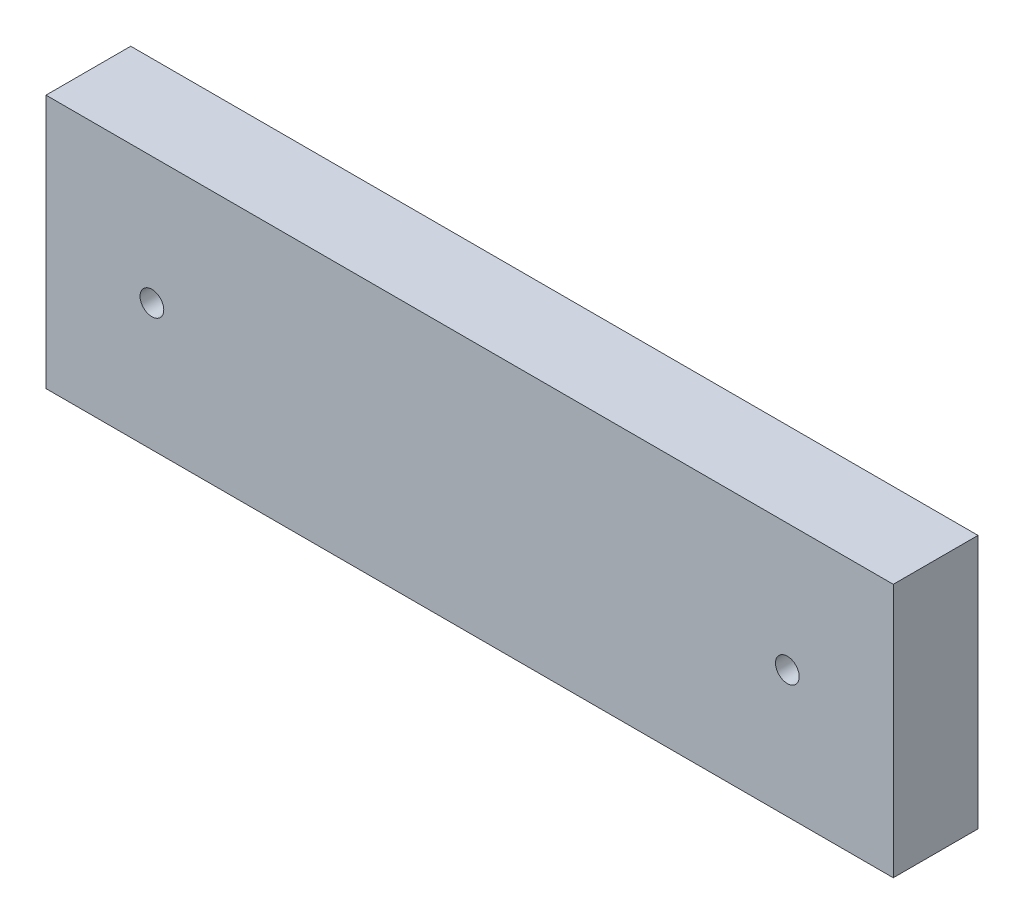
from build123d import *

# Parameters (mm, degrees)
SKETCH_1_W      = 100
SKETCH_1_H      = 30
SKETCH_1_R      = 1.4
EXTRUDE_1_DEPTH = 10


with BuildPart() as part:
    # 스케치1 → 보스-돌출1 (new body)
    with BuildSketch(Plane.XY):
        Rectangle(SKETCH_1_W, SKETCH_1_H)
        with Locations((-37.5, 0)):
            Circle(SKETCH_1_R, mode=Mode.SUBTRACT)
        with Locations(Location((37.5, 0, 0), (0, 0, 180))):
            Circle(SKETCH_1_R, mode=Mode.SUBTRACT)
    extrude(amount=EXTRUDE_1_DEPTH)


solid = part.part
